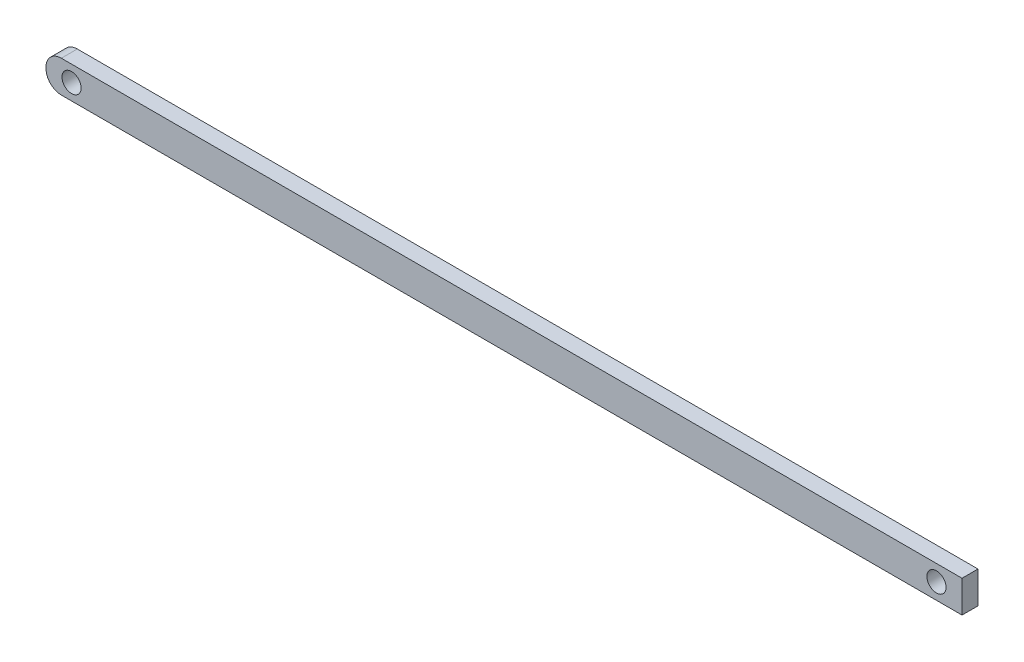
from build123d import *

# Parameters (mm, degrees)
SKETCH1_W               = 717
SKETCH1_H               = 25
SKETCH1_R               = 7.5
BOSS_EXTRUDE1_DEPTH     = 25
FILLET1_R               = 12
CUT_EXTRUDE1_DEPTH      = 718.544597917
CUT_EXTRUDE1_DEPTH_BACK = 718.544597917
SKETCH2_W               = 12.5
SKETCH2_H               = 25


with BuildPart() as part:
    # Sketch1 → Boss-Extrude1 (new body)
    with BuildSketch(Plane.XY):
        Rectangle(SKETCH1_W, SKETCH1_H)
        with Locations((-338.5, 0)):
            Circle(SKETCH1_R, mode=Mode.SUBTRACT)
        with Locations((338.5, 0)):
            Circle(SKETCH1_R, mode=Mode.SUBTRACT)
    extrude(amount=BOSS_EXTRUDE1_DEPTH)

    # Fillet1
    fillet1_edges = [part.edges().sort_by_distance(p)[0] for p in [
        (-358.5, -12.5, 12.5),
        (-358.5, 12.5, 12.5),
    ]]
    fillet(fillet1_edges, radius=FILLET1_R)

    # Sketch2 → Cut-Extrude1 (cut, two sides: drawn at the far end of the back side and taken through both)
    with BuildSketch(Plane(origin=(358.5, 0, 0), x_dir=(0, 0, -1), z_dir=(1, 0, 0)).offset(-CUT_EXTRUDE1_DEPTH_BACK)):
        with Locations((-6.25, 0)):
            Rectangle(SKETCH2_W, SKETCH2_H)
    extrude(amount=CUT_EXTRUDE1_DEPTH + CUT_EXTRUDE1_DEPTH_BACK, mode=Mode.SUBTRACT)


solid = part.part
